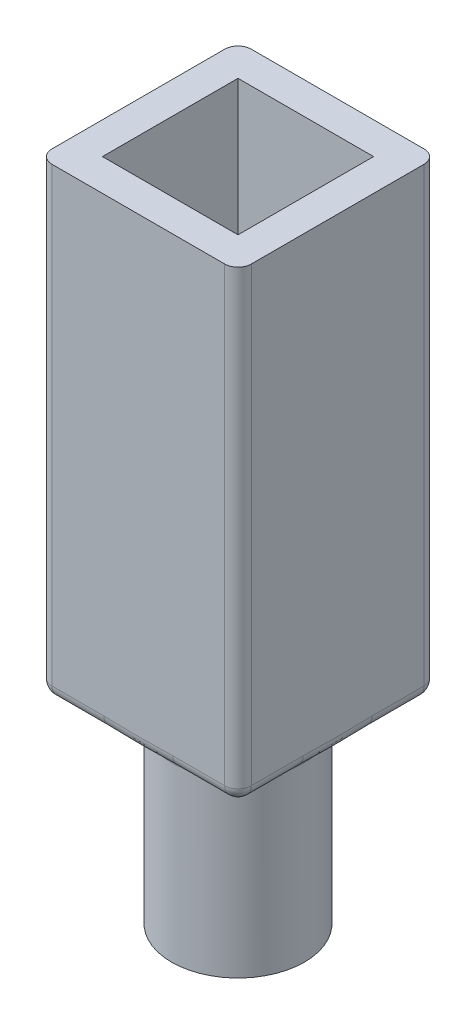
from build123d import *

# Parameters (mm, degrees)
SKETCH_1_R          = 5
EXTRUDE_1_DEPTH     = 15
SKETCH_2_W          = 15
SKETCH_2_H          = 15
EXTRUDE_2_DEPTH     = 3
FILLET_1_R          = 2
SKETCH_3_W          = 15
SKETCH_3_H          = 15
SKETCH_3_W_2        = 10.2
SKETCH_3_H_2        = 10.2
EXTRUDE_3_DEPTH     = 32
CUT_EXTRUDE_1_DEPTH = 10
FILLET_2_R          = 1


with BuildPart() as part:
    # 草图1 → 凸台-拉伸1 (new body)
    with BuildSketch(Plane(origin=(0, 0, 0), x_dir=(1, 0, 0), z_dir=(0, 1, 0))):
        with Locations(Location((0, 0, 0), (0, 0, 270))):
            Circle(SKETCH_1_R)
    extrude(amount=EXTRUDE_1_DEPTH)

    # 草图2 → 凸台-拉伸2 (add)
    with BuildSketch(Plane(origin=(0, 15, 0), x_dir=(1, 0, 0), z_dir=(0, 1, 0))):
        Rectangle(SKETCH_2_W, SKETCH_2_H)
    extrude(amount=EXTRUDE_2_DEPTH)

    # 圆角1
    fillet_1_edges = [part.edges().sort_by_distance(p)[0] for p in [
        (0, 15, -5),
    ]]
    fillet(fillet_1_edges, radius=FILLET_1_R)

    # 草图3 → 凸台-拉伸3 (add)
    with BuildSketch(Plane(origin=(0, 18, 0), x_dir=(1, 0, 0), z_dir=(0, 1, 0))):
        Rectangle(SKETCH_3_W, SKETCH_3_H)
        Rectangle(SKETCH_3_W_2, SKETCH_3_H_2, mode=Mode.SUBTRACT)
    extrude(amount=EXTRUDE_3_DEPTH)

    # 草图4 → 切除-拉伸1 (cut)
    with BuildSketch(Plane.XZ):
        with BuildLine():
            Line((-1.85, 2.034698995), (-1.85, -2.034698995))
            ThreePointArc((-1.85, -2.034698995), (1.112429773, -2.514955268), (2.75, 0))
            ThreePointArc((2.75, 0), (1.112429773, 2.514955268), (-1.85, 2.034698995))
        make_face()
    extrude(amount=-CUT_EXTRUDE_1_DEPTH, mode=Mode.SUBTRACT)

    # 圆角2
    fillet_2_edges = [part.edges().sort_by_distance(p)[0] for p in [
        (-7.5, 15, 0),
        (-7.5, 32.5, -7.5),
        (0, 15, 7.5),
        (-7.5, 32.5, 7.5),
        (7.5, 15, 0),
        (7.5, 32.5, 7.5),
        (0, 15, -7.5),
        (7.5, 32.5, -7.5),
    ]]
    fillet(fillet_2_edges, radius=FILLET_2_R)


solid = part.part
